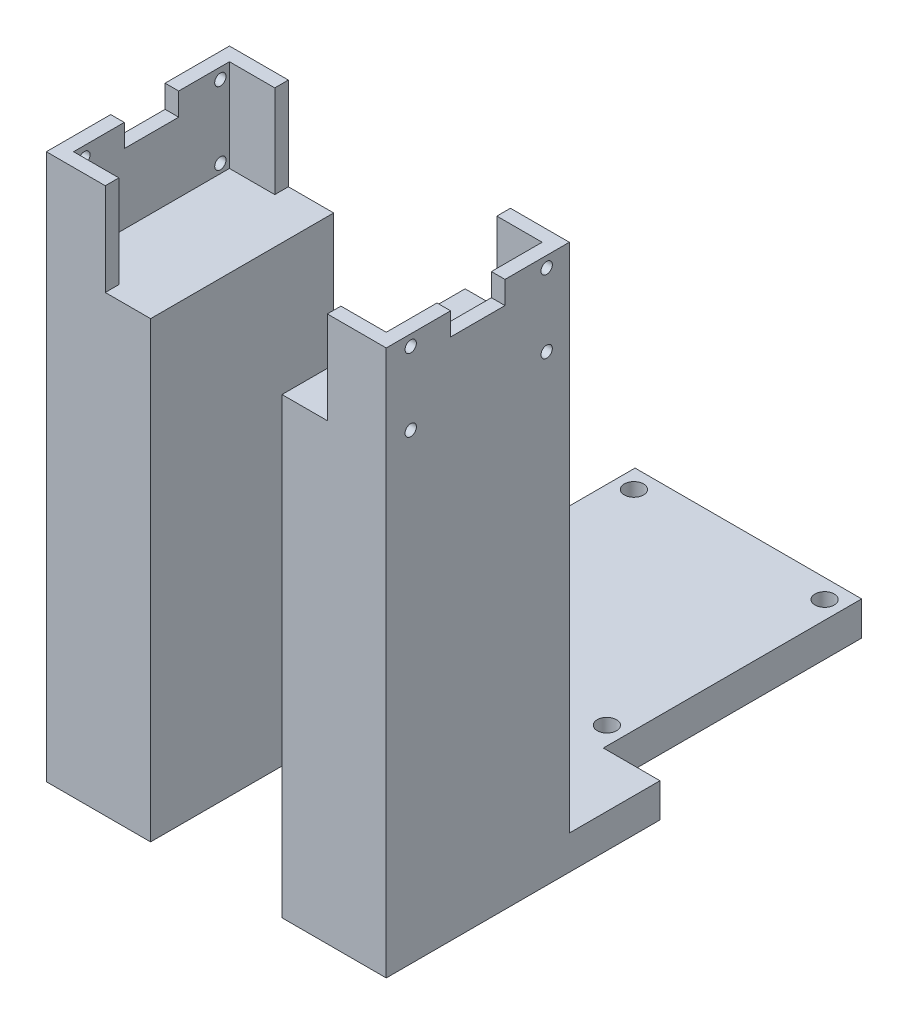
from build123d import *

# Parameters (mm, degrees)
BOSS_EXTRUDE1_START = -34.5
SKETCH2_W           = 34.4
SKETCH2_H           = 20.4
SKETCH2_R           = 1.25
BOSS_EXTRUDE1_DEPTH = 3
SKETCH1_W           = 13
SKETCH1_H           = 3
BOSS_EXTRUDE2_DEPTH = 20.4
SKETCH1_3_W         = 20
SKETCH1_3_H         = 34.4
SKETCH1_3_W_2       = 10
SKETCH1_3_H_2       = 3
SKETCH1_3_W_3       = 3
BOSS_EXTRUDE3_DEPTH = 3
SKETCH1_4_W         = 3
SKETCH1_4_H         = 34.4
SKETCH1_4_W_2       = 10
SKETCH1_4_H_2       = 3
SKETCH1_4_W_3       = 20
BOSS_EXTRUDE4_DEPTH = 100
SKETCH4_W           = 12
SKETCH4_H           = 10
CUT_EXTRUDE1_DEPTH  = 132
SKETCH7_W           = 50
SKETCH7_H           = 57
SKETCH7_R           = 2.125
BOSS_EXTRUDE5_DEPTH = 7.5


with BuildPart() as part:
    # Sketch2 → Boss-Extrude1 (new body)
    with BuildSketch(Plane(origin=(0, 0, 0), x_dir=(0, 0, -1), z_dir=(1, 0, 0)).offset(BOSS_EXTRUDE1_START)):
        with Locations((0, 10.2)):
            Rectangle(SKETCH2_W, SKETCH2_H)
        with Locations((-14.8, 18)):
            Circle(SKETCH2_R, mode=Mode.SUBTRACT)
        with Locations(Location((-14.8, 2, 0), (0, 0, 180))):
            Circle(SKETCH2_R, mode=Mode.SUBTRACT)
        with Locations((15.2, 2)):
            Circle(SKETCH2_R, mode=Mode.SUBTRACT)
        with Locations(Location((15.2, 18, 0), (0, 0, 180))):
            Circle(SKETCH2_R, mode=Mode.SUBTRACT)
    extrude(amount=-BOSS_EXTRUDE1_DEPTH)

    # Sketch1 → Boss-Extrude2 (add)
    with BuildSketch(Plane(origin=(0, 0, 0), x_dir=(1, 0, 0), z_dir=(0, 1, 0))):
        with Locations((-31, -18.7)):
            Rectangle(SKETCH1_W, SKETCH1_H)
        with Locations((-31, 18.7)):
            Rectangle(SKETCH1_W, SKETCH1_H)
    extrude(amount=BOSS_EXTRUDE2_DEPTH)

    # Sketch1<3> → Boss-Extrude3 (add)
    with BuildSketch(Plane(origin=(0, 0, 0), x_dir=(1, 0, 0), z_dir=(0, 1, 0))):
        with Locations((-24.5, 0)):
            Rectangle(SKETCH1_3_W, SKETCH1_3_H)
        with Locations((-19.5, -18.7)):
            Rectangle(SKETCH1_3_W_2, SKETCH1_3_H_2)
        Polygon((-24.5, -20.2), (-24.5, -17.2), (-34.5, -17.2), (-37.5, -17.2), (-37.5, -20.2), align=None)
        with Locations((-36, 0)):
            Rectangle(SKETCH1_3_W_3, SKETCH1_3_H)
        Polygon((-34.5, 17.2), (-24.5, 17.2), (-24.5, 20.2), (-37.5, 20.2), (-37.5, 17.2), align=None)
        with Locations((-19.5, 18.7)):
            Rectangle(SKETCH1_3_W_2, SKETCH1_3_H_2)
    extrude(amount=-BOSS_EXTRUDE3_DEPTH)

    # Sketch1<4> → Boss-Extrude4 (add)
    with BuildSketch(Plane(origin=(0, 0, 0), x_dir=(1, 0, 0), z_dir=(0, 1, 0))):
        with Locations((-36, 0)):
            Rectangle(SKETCH1_4_W, SKETCH1_4_H)
        Polygon((-24.5, -20.2), (-24.5, -17.2), (-34.5, -17.2), (-37.5, -17.2), (-37.5, -20.2), align=None)
        with Locations((-19.5, -18.7)):
            Rectangle(SKETCH1_4_W_2, SKETCH1_4_H_2)
        with Locations((-24.5, 0)):
            Rectangle(SKETCH1_4_W_3, SKETCH1_4_H)
        Polygon((-34.5, 17.2), (-24.5, 17.2), (-24.5, 20.2), (-37.5, 20.2), (-37.5, 17.2), align=None)
        with Locations((-19.5, 18.7)):
            Rectangle(SKETCH1_4_W_2, SKETCH1_4_H_2)
    extrude(amount=-BOSS_EXTRUDE4_DEPTH)

    # Sketch4 → Cut-Extrude1 (cut)
    with BuildSketch(Plane(origin=(-34.5, 0, 0), x_dir=(0, 0, -1), z_dir=(1, 0, 0))):
        with Locations((0, 20.4)):
            Rectangle(SKETCH4_W, SKETCH4_H)
    extrude(amount=-CUT_EXTRUDE1_DEPTH, mode=Mode.SUBTRACT)


with BuildPart() as body_2:
    # Mirror6: mirrored copy
    add(part.part.mirror(Plane(origin=(0, 0, 0), x_dir=(0, 0, 1), z_dir=(1, 0, 0))))


with BuildPart() as part_1:
    add(part.part)

    add(body_2.part)  # Boss-Extrude5 merges body 2
    # Sketch7 → Boss-Extrude5 (add)
    # profile 1 of 2: a face of its own
    with BuildSketch(Plane.XZ.offset(100)):
        Polygon((-14.5, -20.2), (14.5, -20.2), (37.5, -20.2), (37.5, -40.2), (-37.5, -40.2), (-37.5, -20.2), align=None)
    # profile 2 of 2: a face of its own
    with BuildSketch(Plane.XZ.offset(100)):
        with Locations((0, -68.7)):
            Rectangle(SKETCH7_W, SKETCH7_H)
        with Locations(Location((-21.035, -92.99, 0), (0, 0, 270))):
            Circle(SKETCH7_R, mode=Mode.SUBTRACT)
        with Locations(Location((-21.035, -44.95, 0), (0, 0, 270))):
            Circle(SKETCH7_R, mode=Mode.SUBTRACT)
        with Locations(Location((21.035, -92.99, 0), (0, 0, 270))):
            Circle(SKETCH7_R, mode=Mode.SUBTRACT)
        with Locations(Location((21.035, -44.95, 0), (0, 0, 270))):
            Circle(SKETCH7_R, mode=Mode.SUBTRACT)
    extrude(amount=-BOSS_EXTRUDE5_DEPTH)


solid = part_1.part
